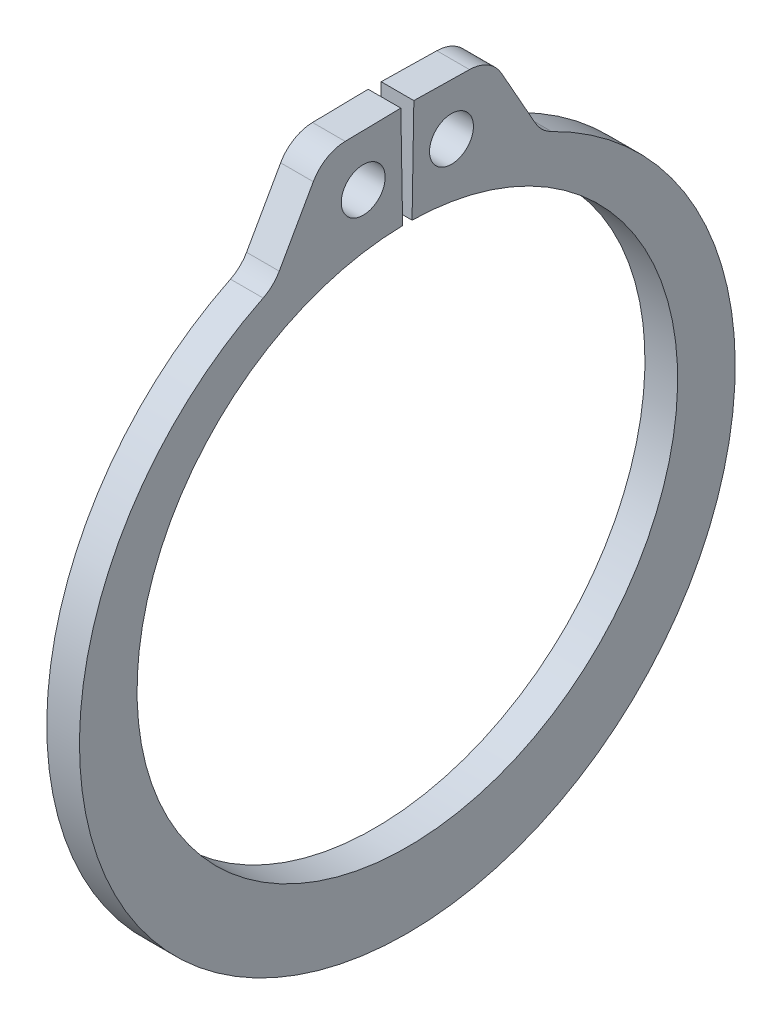
from build123d import *

# Parameters (mm, degrees)
SKETCH1_R      = 0.5969
EXTRUDE1_DEPTH = 0.4445
FILLET1_R      = 1.016


with BuildPart() as part:
    # Sketch1 → Extrude1 (new, symmetric)
    with BuildSketch(Plane(origin=(0, 0, 0), x_dir=(0, 0, -1), z_dir=(1, 0, 0))):
        with BuildLine():
            Line((-0.12833278, 7.352180057), (-0.177094804, 10.145754517))
            Line((-0.177094804, 10.145754517), (-2.272275649, 10.109182999))
            Line((-2.272275649, 10.109182999), (-3.644085943, 7.675138522))
            ThreePointArc((-3.644085943, 7.675138522), (0, -9.3853), (3.644085943, 7.675138522))
            Line((3.644085943, 7.675138522), (2.272275649, 10.109182999))
            Line((2.272275649, 10.109182999), (0.177094804, 10.145754517))
            Line((0.177094804, 10.145754517), (0.12833278, 7.352180057))
            ThreePointArc((0.12833278, 7.352180057), (0, -7.3533), (-0.12833278, 7.352180057))
        make_face()
        with Locations((-1.200304215, 8.730681528)):
            Circle(SKETCH1_R, mode=Mode.SUBTRACT)
        with Locations((1.200304215, 8.730681528)):
            Circle(SKETCH1_R, mode=Mode.SUBTRACT)
    extrude(amount=EXTRUDE1_DEPTH, both=True)

    # Fillet1
    fillet1_edges = [part.edges().sort_by_distance(p)[0] for p in [
        (0, 10.109182999, -2.272275649),
        (0, 7.675138522, -3.644085943),
        (0, 7.675138522, 3.644085943),
        (0, 10.109182999, 2.272275649),
    ]]
    fillet(fillet1_edges, radius=FILLET1_R)


solid = part.part
